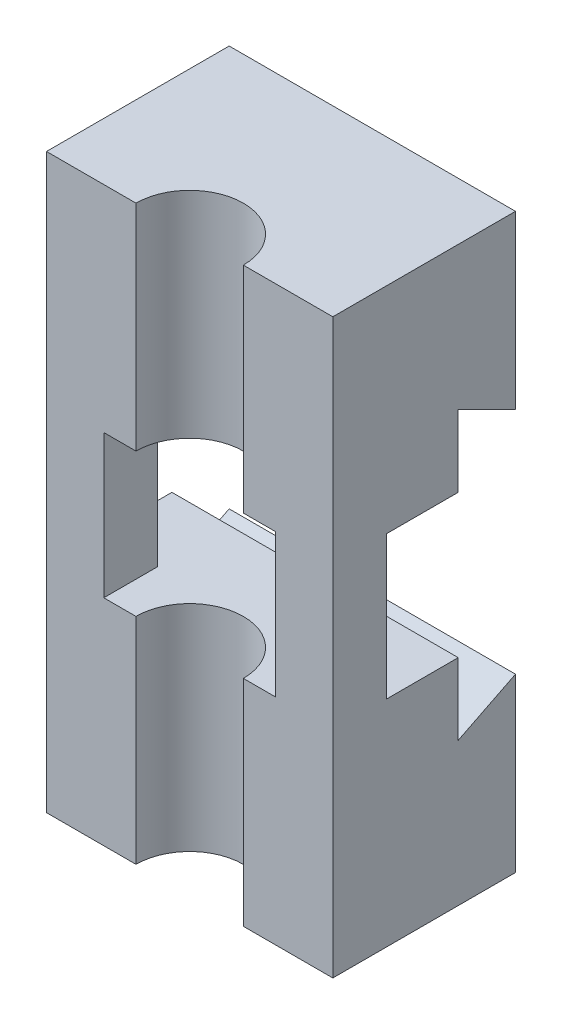
from build123d import *

# Parameters (mm, degrees)
BOSS_EXTRUDE1_DEPTH     = 10
CUT_EXTRUDE2_DEPTH      = 4.88
CUT_EXTRUDE4_DEPTH      = 18.67766953
CUT_EXTRUDE4_DEPTH_BACK = 18.67766953
SKETCH6_3_R             = 1.875
CUT_EXTRUDE5_DEPTH      = 24.58495283
CUT_EXTRUDE5_DEPTH_BACK = 24.58495283
SKETCH7_OUTSIDE_W       = 17.386
SKETCH7_OUTSIDE_H       = 22.386
SKETCH7_OUTSIDE_W_2     = 10
SKETCH7_OUTSIDE_H_2     = 6.38


with BuildPart() as part:
    # Sketch2 → Boss-Extrude1 (new body)
    with BuildSketch(Plane.YZ):
        Polygon((-10, -7.5), (-4, -7.5), (-5, -5.5), (-2.5, -5.5), (-2.5, -3), (2.5, -3), (2.5, -5.5), (5, -5.5), (4, -7.5), (10, -7.5), (10, 7.5), (-10, 7.5), align=None)
    extrude(amount=BOSS_EXTRUDE1_DEPTH)

    # Sketch4 → Cut-Extrude2 (cut)
    with BuildSketch(Plane(origin=(0, 0, -3), x_dir=(1, 0, 0), z_dir=(0, 0, -1))):
        Polygon((5, 2.5), (2, 2.5), (2, -2.5), (8, -2.5), (8, 2.5), align=None)
    extrude(amount=-CUT_EXTRUDE2_DEPTH, mode=Mode.SUBTRACT)

    # Sketch6<3> → Cut-Extrude4 (cut, two sides: drawn at the far end of the back side and taken through both)
    with BuildSketch(Plane.XZ.offset(-2.5).offset(-CUT_EXTRUDE4_DEPTH_BACK)):
        with Locations((5, -1.12)):
            Circle(SKETCH6_3_R)
    extrude(amount=CUT_EXTRUDE4_DEPTH + CUT_EXTRUDE4_DEPTH_BACK, mode=Mode.SUBTRACT)

    # Sketch7 outside → Cut-Extrude5 (cut, two sides: drawn at the far end of the back side and taken through both)
    with BuildSketch(Plane(origin=(0, 10, 0), x_dir=(-1, 0, 0), z_dir=(0, 1, 0)).offset(-CUT_EXTRUDE5_DEPTH_BACK)):
        with Locations((-5, 0)):
            Rectangle(SKETCH7_OUTSIDE_W, SKETCH7_OUTSIDE_H)
        with Locations((-5, -4.31)):
            Rectangle(SKETCH7_OUTSIDE_W_2, SKETCH7_OUTSIDE_H_2, mode=Mode.SUBTRACT)
    extrude(amount=CUT_EXTRUDE5_DEPTH + CUT_EXTRUDE5_DEPTH_BACK, mode=Mode.SUBTRACT)


solid = part.part
